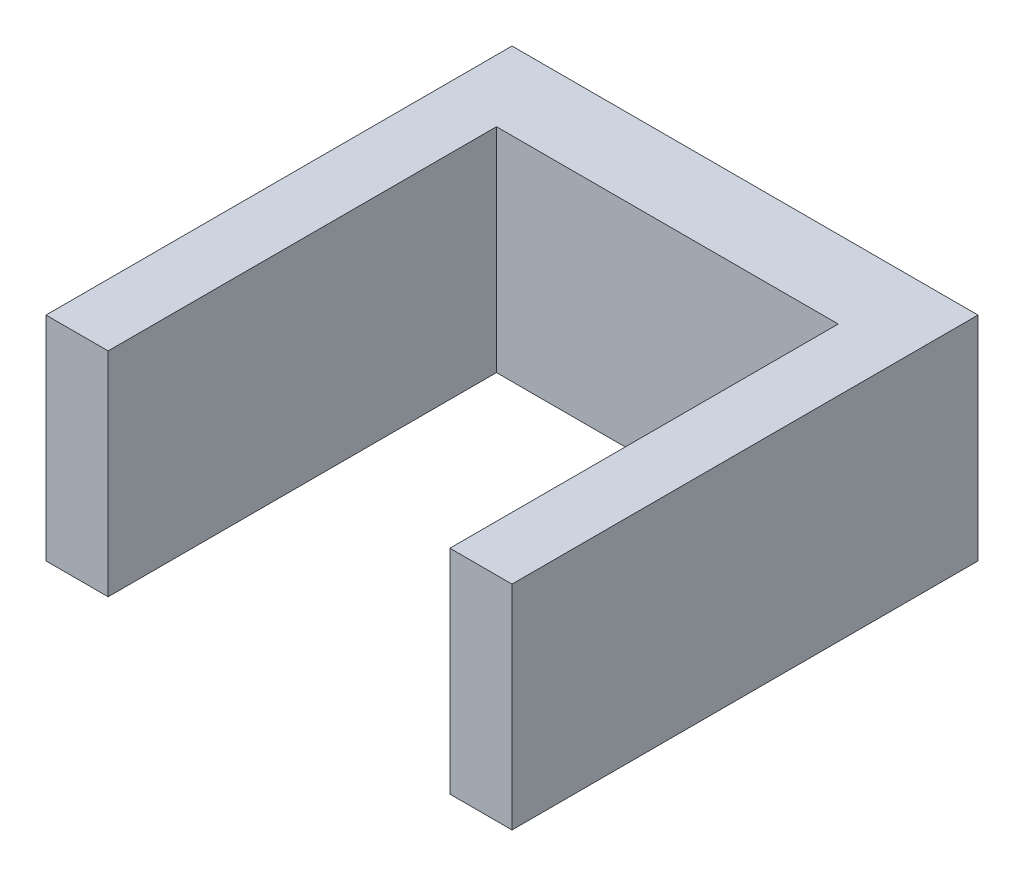
from build123d import *

# Parameters (mm, degrees)
BOSS_EXTRUDE1_DEPTH = 13.71


with BuildPart() as part:
    # Sketch1 → Boss-Extrude1 (new body)
    with BuildSketch(Plane(origin=(0, 0, 0), x_dir=(1, 0, 0), z_dir=(0, 1, 0))):
        Polygon((0, 0), (0, 30), (30, 30), (30, 0), (26, 0), (26, 25), (4, 25), (4, 0), align=None)
    extrude(amount=BOSS_EXTRUDE1_DEPTH)


solid = part.part
